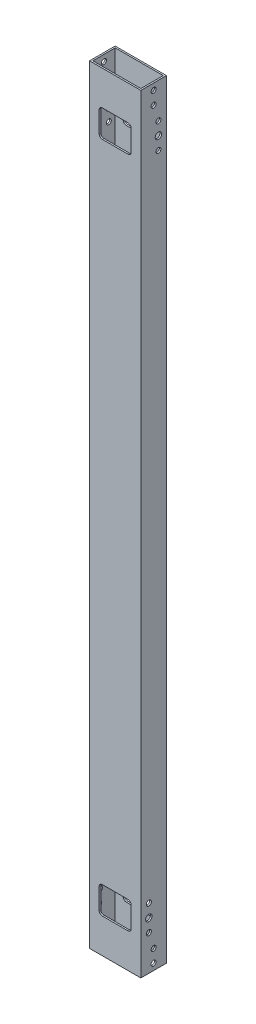
from build123d import *

# Parameters (mm, degrees)
SKETCH1_W               = 50.8
SKETCH1_H               = 762
BOSS_EXTRUDE1_DEPTH     = 12.7
SHELL1_T                = -1.5875
SKETCH3_R               = 2.4892
CUT_EXTRUDE1_DEPTH      = 383.056867495
CUT_EXTRUDE2_DEPTH      = 383.056867495
CUT_EXTRUDE2_DEPTH_BACK = 383.056867495
SKETCH4_R               = 3.175
SKETCH4_R_2             = 2.4892
CUT_EXTRUDE4_DEPTH      = 383.056867495
CUT_EXTRUDE4_DEPTH_BACK = 383.056867495
SKETCH5_W               = 31.75
SKETCH5_H               = 26.9875
FILLET1_R               = 3.175


with BuildPart() as part:
    # Sketch1 → Boss-Extrude1 (new, symmetric)
    with BuildSketch(Plane.XY):
        Rectangle(SKETCH1_W, SKETCH1_H)
    extrude(amount=BOSS_EXTRUDE1_DEPTH, both=True)

    # Shell1
    shell1_openings = [part.faces().sort_by_distance(p)[0] for p in [
        (0, -381, 0),
        (0, 381, 0),
    ]]
    offset(amount=SHELL1_T, openings=shell1_openings, kind=Kind.INTERSECTION)

    # Sketch3 → Cut-Extrude1 (cut, symmetric)
    with BuildSketch(Plane(origin=(0, 0, 0), x_dir=(0, 0, -1), z_dir=(1, 0, 0))):
        with Locations((0, -374.65)):
            Circle(SKETCH3_R)
        with Locations((0, -361.95)):
            Circle(SKETCH3_R)
    cut_extrude1 = extrude(amount=CUT_EXTRUDE1_DEPTH, both=True, mode=Mode.SUBTRACT)

    # Sketch4 → Cut-Extrude2 (cut, two sides: drawn at the far end of the back side and taken through both)
    with BuildSketch(Plane(origin=(0, 0, 0), x_dir=(0, 0, -1), z_dir=(1, 0, 0)).offset(-CUT_EXTRUDE2_DEPTH_BACK)):
        with Locations((4.7625, 333.375)):
            Circle(SKETCH4_R)
        with Locations((4.7625, 346.075)):
            Circle(SKETCH4_R_2)
        with Locations((4.7625, 320.675)):
            Circle(SKETCH4_R_2)
        with Locations((-4.7625, -333.375)):
            Circle(SKETCH4_R)
        with Locations((-4.7625, -320.675)):
            Circle(SKETCH4_R_2)
        with Locations((-4.7625, -346.075)):
            Circle(SKETCH4_R_2)
    extrude(amount=CUT_EXTRUDE2_DEPTH + CUT_EXTRUDE2_DEPTH_BACK, mode=Mode.SUBTRACT)

    # Mirror1: Cut-Extrude1 across plane
    add(cut_extrude1.mirror(Plane.ZX), mode=Mode.SUBTRACT)

    # Sketch5 → Cut-Extrude4 (cut, two sides: drawn at the far end of the back side and taken through both)
    with BuildSketch(Plane.XY.offset(-CUT_EXTRUDE4_DEPTH_BACK)):
        with Locations((0, -333.375)):
            Rectangle(SKETCH5_W, SKETCH5_H)
        with Locations((0, 333.375)):
            Rectangle(SKETCH5_W, SKETCH5_H)
    extrude(amount=CUT_EXTRUDE4_DEPTH + CUT_EXTRUDE4_DEPTH_BACK, mode=Mode.SUBTRACT)

    # Fillet1
    fillet1_edges = [part.edges().sort_by_distance(p)[0] for p in [
        (-15.875, -346.86875, -11.90625),
        (-15.875, -319.88125, -11.90625),
        (15.875, -319.88125, -11.90625),
        (15.875, -346.86875, -11.90625),
        (-15.875, -346.86875, 11.90625),
        (-15.875, -319.88125, 11.90625),
        (15.875, -319.88125, 11.90625),
        (15.875, -346.86875, 11.90625),
        (15.875, 319.88125, -11.90625),
        (-15.875, 319.88125, -11.90625),
        (-15.875, 346.86875, -11.90625),
        (15.875, 346.86875, -11.90625),
        (15.875, 319.88125, 11.90625),
        (-15.875, 319.88125, 11.90625),
        (-15.875, 346.86875, 11.90625),
        (15.875, 346.86875, 11.90625),
    ]]
    fillet(fillet1_edges, radius=FILLET1_R)


solid = part.part
